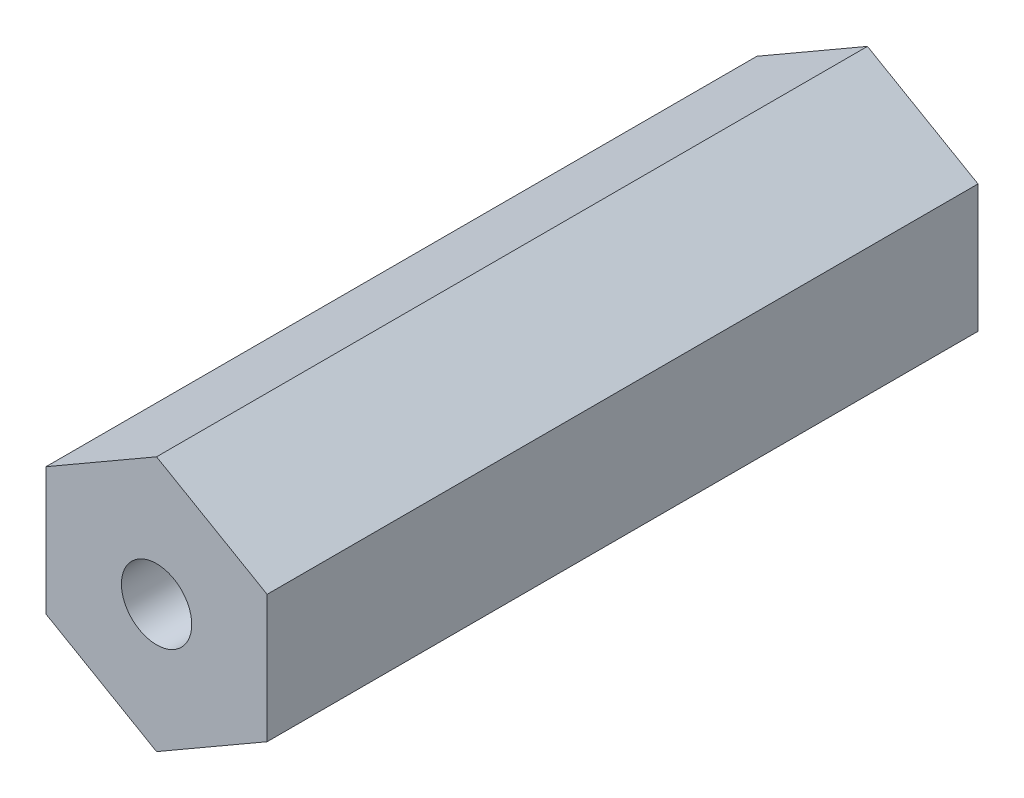
from build123d import *

# Parameters (mm, degrees)
SKETCH1_R           = 2.0193
BOSS_EXTRUDE1_DEPTH = 40.8305


with BuildPart() as part:
    # Sketch1 → Boss-Extrude1 (new body)
    with BuildSketch(Plane.XY):
        Polygon((0, 7.332348419), (-6.35, 3.666174209), (-6.35, -3.666174209), (0, -7.332348419), (6.35, -3.666174209), (6.35, 3.666174209), align=None)
        Circle(SKETCH1_R, mode=Mode.SUBTRACT)
    extrude(amount=BOSS_EXTRUDE1_DEPTH)


solid = part.part
